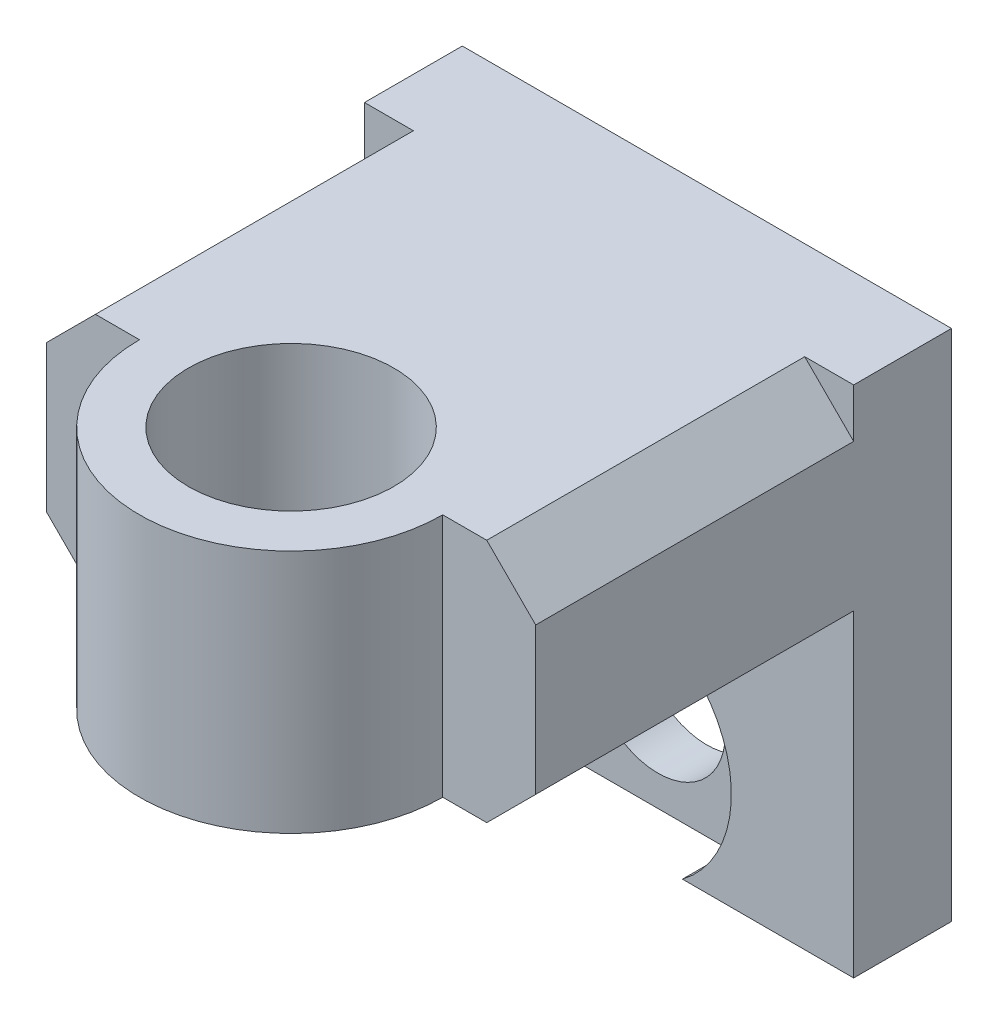
from build123d import *

# Parameters (mm, degrees)
SKETCH_1_W          = 20
SKETCH_1_H          = 32
SKETCH_1_R          = 2.75
EXTRUDE_1_DEPTH     = 4
SKETCH_2_W          = 20
SKETCH_2_H          = 10
EXTRUDE_2_DEPTH     = 13
SKETCH_4_R          = 6.2
EXTRUDE_3_DEPTH     = 10
SKETCH_5_R          = 4.2
CUT_EXTRUDE_1_DEPTH = 13
CHAMFER_1_SIZE      = 2
SKETCH_6_R          = 5
CUT_EXTRUDE_2_DEPTH = 2
SKETCH_7_W          = 20
SKETCH_7_H          = 11
CUT_EXTRUDE_3_DEPTH = 43.339579592


with BuildPart() as part:
    # 草图1 → 凸台-拉伸1 (new body)
    with BuildSketch(Plane.XY):
        with Locations((10, -16)):
            Rectangle(SKETCH_1_W, SKETCH_1_H)
        with Locations((10, -4)):
            Circle(SKETCH_1_R, mode=Mode.SUBTRACT)
        with Locations((10, -28)):
            Circle(SKETCH_1_R, mode=Mode.SUBTRACT)
    extrude(amount=EXTRUDE_1_DEPTH)

    # 草图2 → 凸台-拉伸2 (add)
    with BuildSketch(Plane.XY.offset(4)):
        with Locations((10, -16)):
            Rectangle(SKETCH_2_W, SKETCH_2_H)
    extrude(amount=EXTRUDE_2_DEPTH)

    # 草图4 → 凸台-拉伸3 (add)
    with BuildSketch(Plane.XZ.offset(21)):
        with Locations((10, 17)):
            Circle(SKETCH_4_R)
    extrude(amount=-EXTRUDE_3_DEPTH)

    # 草图5 → 切除-拉伸1 (cut)
    with BuildSketch(Plane(origin=(0, -11, 0), x_dir=(1, 0, 0), z_dir=(0, 1, 0))):
        with Locations(Location((10, -17, 0), (0, 0, 270))):
            Circle(SKETCH_5_R)
    extrude(amount=-CUT_EXTRUDE_1_DEPTH, mode=Mode.SUBTRACT)

    # 倒角1
    chamfer_1_edges = [part.edges().sort_by_distance(p)[0] for p in [
        (0, -11, 10.5),
        (0, -21, 10.5),
        (20, -21, 10.5),
        (20, -11, 10.5),
    ]]
    chamfer(chamfer_1_edges, length=CHAMFER_1_SIZE)

    # 草图6 → 切除-拉伸2 (cut)
    with BuildSketch(Plane.XY.offset(4)):
        with Locations((10, -28)):
            Circle(SKETCH_6_R)
        with Locations((10, -4)):
            Circle(SKETCH_6_R)
    extrude(amount=-CUT_EXTRUDE_2_DEPTH, mode=Mode.SUBTRACT)

    # 草图7 → 切除-拉伸3 (cut, through all)
    with BuildSketch(Plane.XY.offset(4)):
        with Locations((10, -5.5)):
            Rectangle(SKETCH_7_W, SKETCH_7_H)
    extrude(amount=-CUT_EXTRUDE_3_DEPTH, mode=Mode.SUBTRACT)


solid = part.part
